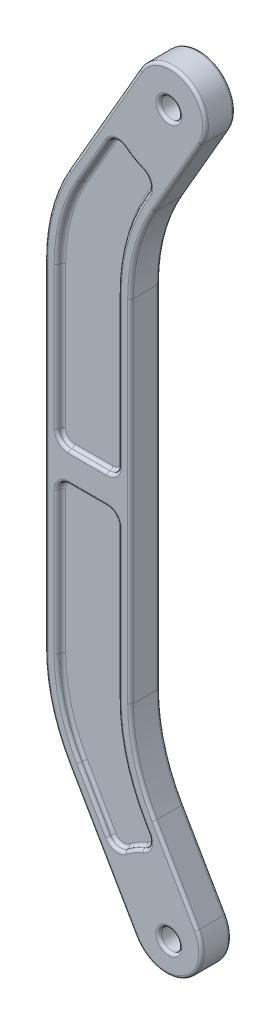
from build123d import *

# Parameters (mm, degrees)
EXTRUDE1_DEPTH      = 25
EXTRUDE1_DEPTH_BACK = 25
SKETCH3_R           = 17.13551903
SKETCH3_R_2         = 17.231991139
CUT_EXTRUDE1_DEPTH  = 10
CUT_EXTRUDE2_START  = -10
CUT_EXTRUDE2_DEPTH  = 10
FILLET1_R           = 4.826


with BuildPart() as part:
    # Sketch3 → Extrude1 (new, two sides: drawn at the far end of the back side and taken through both)
    with BuildSketch(Plane.XY.offset(-EXTRUDE1_DEPTH_BACK)):
        with BuildLine():
            Line((-24.807604607, 162.968065467), (47.382967486, 37.930316294))
            ThreePointArc((47.382967486, 37.930316294), (25.421440238, -44.031207308), (-56.540083363, -22.06968006))
            Line((-56.540083363, -22.06968006), (-169.807605742, 174.115435466))
            ThreePointArc((-169.807605742, 174.115435466), (-199.777732741, 246.469720642), (-209.99998495, 324.115433051))
            Line((-209.99998495, 324.115433051), (-209.99998495, 895.884583051))
            ThreePointArc((-209.99998495, 895.884583051), (-199.777733234, 973.530293564), (-169.807607648, 1045.884577221))
            Line((-169.807607648, 1045.884577221), (-49.82465968, 1253.701139142))
            ThreePointArc((-49.82465968, 1253.701139142), (32.136867624, 1275.662663595), (54.098392078, 1193.701136291))
            Line((54.098392078, 1193.701136291), (-24.807602614, 1057.031932005))
            ThreePointArc((-24.807602614, 1057.031932005), (-54.777728484, 984.677646375), (-64.999978983, 907.031933753))
            Line((-64.999978983, 907.031933753), (-64.999978983, 312.968053753))
            ThreePointArc((-64.999978983, 312.968053753), (-54.777728023, 235.322346461), (-24.807604607, 162.968065467))
        make_face()
        with Locations((0.048253388, 1219.998843051)):
            Circle(SKETCH3_R, mode=Mode.SUBTRACT)
        Circle(SKETCH3_R_2, mode=Mode.SUBTRACT)
    extrude(amount=EXTRUDE1_DEPTH + EXTRUDE1_DEPTH_BACK)

    # Sketch4 → Cut-Extrude1 (cut)
    with BuildSketch(Plane.XY.offset(25)):
        with BuildLine():
            Line((-85.317537612, 654.250003051), (-85.317530612, 907.031943051))
            ThreePointArc((-85.317530612, 907.031943051), (-74.402975126, 989.936220177), (-42.403118467, 1067.19070782))
            Line((-42.403118467, 1067.19070782), (-34.916014702, 1080.158771121))
            ThreePointArc((-34.916014702, 1080.158771121), (-33.363347921, 1096.442599596), (-44.656305727, 1108.276573903))
            ThreePointArc((-44.656305727, 1108.276573903), (-60.158769666, 1115.801958004), (-74.427174934, 1125.464794293))
            ThreePointArc((-74.427174934, 1125.464794293), (-90.322173256, 1129.327794011), (-103.648046289, 1119.841232651))
            Line((-103.648046289, 1119.841232651), (-152.212117713, 1035.725805096))
            ThreePointArc((-152.212117713, 1035.725805096), (-180.152510116, 968.271725823), (-189.682457612, 895.884583051))
            Line((-189.682457612, 895.884583051), (-189.682457612, 654.250003051))
            ThreePointArc((-189.682457612, 654.250003051), (-183.917598549, 640.332402114), (-169.999997612, 634.567543051))
            Line((-169.999997612, 634.567543051), (-104.999997612, 634.567543051))
            ThreePointArc((-104.999997612, 634.567543051), (-91.082396676, 640.332402114), (-85.317537612, 654.250003051))
        make_face()
        with BuildLine():
            Line((-152.212114349, 184.274207066), (-103.648045955, 100.158773186))
            ThreePointArc((-103.648045955, 100.158773186), (-90.322172483, 90.672211653), (-74.427173724, 94.535211517))
            ThreePointArc((-74.427173724, 94.535211517), (-60.158768087, 104.198048078), (-44.656303761, 111.723432429))
            ThreePointArc((-44.656303761, 111.723432429), (-33.363351675, 123.557400275), (-34.916017531, 139.841220175))
            Line((-34.916017531, 139.841220175), (-42.403127531, 152.809280175))
            ThreePointArc((-42.403127531, 152.809280175), (-74.402986959, 230.063776572), (-85.317541475, 312.968063051))
            Line((-85.317541475, 312.968063051), (-85.317541475, 564.750003051))
            ThreePointArc((-85.317541475, 564.750003051), (-91.082399138, 578.667600573), (-104.999996681, 584.432458189))
            Line((-104.999996681, 584.432458189), (-169.999996647, 584.432463051))
            ThreePointArc((-169.999996647, 584.432463051), (-183.917597561, 578.667603975), (-189.682456612, 564.750003051))
            Line((-189.682456612, 564.750003051), (-189.682456612, 324.115433051))
            ThreePointArc((-189.682456612, 324.115433051), (-180.152508504, 251.72828807), (-152.212114349, 184.274207066))
        make_face()
    extrude(amount=-CUT_EXTRUDE1_DEPTH, mode=Mode.SUBTRACT)

    # Sketch5 → Cut-Extrude2 (cut)
    with BuildSketch(Plane(origin=(0, 0, -25), x_dir=(-1, 0, 0), z_dir=(0, 0, -1)).offset(CUT_EXTRUDE2_START)):
        with BuildLine():
            Line((85.317530612, 907.031943051), (85.317537612, 654.250003051))
            ThreePointArc((85.317537612, 654.250003051), (91.082396676, 640.332402114), (104.999997612, 634.567543051))
            Line((104.999997612, 634.567543051), (169.999997612, 634.567543051))
            ThreePointArc((169.999997612, 634.567543051), (183.917598549, 640.332402114), (189.682457612, 654.250003051))
            Line((189.682457612, 654.250003051), (189.682457612, 895.884583051))
            ThreePointArc((189.682457612, 895.884583051), (180.152510116, 968.271725823), (152.212117713, 1035.725805096))
            Line((152.212117713, 1035.725805096), (103.648046289, 1119.841232651))
            ThreePointArc((103.648046289, 1119.841232651), (90.322173256, 1129.327794011), (74.427174934, 1125.464794293))
            ThreePointArc((74.427174934, 1125.464794293), (60.158769666, 1115.801958004), (44.656305727, 1108.276573903))
            ThreePointArc((44.656305727, 1108.276573903), (33.363347921, 1096.442599596), (34.916014702, 1080.158771121))
            Line((34.916014702, 1080.158771121), (42.403118467, 1067.19070782))
            ThreePointArc((42.403118467, 1067.19070782), (74.402975126, 989.936220177), (85.317530612, 907.031943051))
        make_face()
        with BuildLine():
            Line((103.648045955, 100.158773186), (152.212114349, 184.274207066))
            ThreePointArc((152.212114349, 184.274207066), (180.152508504, 251.72828807), (189.682456612, 324.115433051))
            Line((189.682456612, 324.115433051), (189.682456612, 564.750003051))
            ThreePointArc((189.682456612, 564.750003051), (183.917597561, 578.667603975), (169.999996647, 584.432463051))
            Line((169.999996647, 584.432463051), (104.999996681, 584.432458189))
            ThreePointArc((104.999996681, 584.432458189), (91.082399138, 578.667600573), (85.317541475, 564.750003051))
            Line((85.317541475, 564.750003051), (85.317541475, 312.968063051))
            ThreePointArc((85.317541475, 312.968063051), (74.402986959, 230.063776572), (42.403127531, 152.809280175))
            Line((42.403127531, 152.809280175), (34.916017531, 139.841220175))
            ThreePointArc((34.916017531, 139.841220175), (33.363351675, 123.557400275), (44.656303761, 111.723432429))
            ThreePointArc((44.656303761, 111.723432429), (60.158768087, 104.198048078), (74.427173724, 94.535211517))
            ThreePointArc((74.427173724, 94.535211517), (90.322172483, 90.672211653), (103.648045955, 100.158773186))
        make_face()
    extrude(amount=CUT_EXTRUDE2_DEPTH, mode=Mode.SUBTRACT)

    # Fillet1
    fillet1_edges = [part.edges().sort_by_distance(p)[0] for p in [
        (-64.999978983, 609.999993753, 25),
        (-64.999978983, 609.999993753, -25),
        (-54.777728484, 984.677646375, 25),
        (-54.777728023, 235.322346461, 25),
        (14.645394732, 1125.366534148, 25),
        (11.28768144, 100.44919088, 25),
        (32.136867624, 1275.662663595, 25),
        (25.421440238, -44.031207308, 25),
        (-109.816133664, 1149.792858181, 25),
        (-113.173844553, 76.022877703, 25),
        (-199.777733234, 973.530293564, 25),
        (-199.777732741, 246.469720642, 25),
        (-209.99998495, 610.000008051, 25),
        (-17.231991139, 0, 25),
        (-180.152508504, 251.72828807, 25),
        (-189.682456612, 444.432718051, 25),
        (-183.917597561, 578.667603975, 25),
        (-137.499996664, 584.43246062, 25),
        (-91.082399138, 578.667600573, 25),
        (-85.317541475, 438.859033051, 25),
        (-74.402986959, 230.063776572, 25),
        (-38.659572531, 146.325250175, 25),
        (-33.363351675, 123.557400275, 25),
        (-60.158768087, 104.198048078, 25),
        (-90.322172483, 90.672211653, 25),
        (-127.930080152, 142.216490126, 25),
        (-17.087265643, 1219.998843051, 25),
        (-90.322173256, 1129.327794011, 25),
        (-60.158769666, 1115.801958004, 25),
        (-33.363347921, 1096.442599596, 25),
        (-38.659566585, 1073.67473947, 25),
        (-74.402975126, 989.936220177, 25),
        (-85.317534112, 780.640973051, 25),
        (-91.082396676, 640.332402114, 25),
        (-137.499997612, 634.567543051, 25),
        (-183.917598549, 640.332402114, 25),
        (-189.682457612, 775.067293051, 25),
        (-180.152510116, 968.271725823, 25),
        (-127.930082001, 1077.783518873, 25),
        (-54.777728023, 235.322346461, -25),
        (-54.777728484, 984.677646375, -25),
        (14.645394732, 1125.366534148, -25),
        (11.28768144, 100.44919088, -25),
        (32.136867624, 1275.662663595, -25),
        (25.421440238, -44.031207308, -25),
        (-109.816133664, 1149.792858181, -25),
        (-113.173844553, 76.022877703, -25),
        (-199.777733234, 973.530293564, -25),
        (-199.777732741, 246.469720642, -25),
        (-209.99998495, 610.000008051, -25),
        (-17.231991139, 0, -25),
        (-38.659572531, 146.325250175, -25),
        (-33.363351675, 123.557400275, -25),
        (-60.158768087, 104.198048078, -25),
        (-90.322172483, 90.672211653, -25),
        (-127.930080152, 142.216490126, -25),
        (-180.152508504, 251.72828807, -25),
        (-189.682456612, 444.432718051, -25),
        (-183.917597561, 578.667603975, -25),
        (-137.499996664, 584.43246062, -25),
        (-91.082399138, 578.667600573, -25),
        (-85.317541475, 438.859033051, -25),
        (-74.402986959, 230.063776572, -25),
        (-17.087265643, 1219.998843051, -25),
        (-38.659566585, 1073.67473947, -25),
        (-74.402975126, 989.936220177, -25),
        (-85.317534112, 780.640973051, -25),
        (-91.082396676, 640.332402114, -25),
        (-137.499997612, 634.567543051, -25),
        (-183.917598549, 640.332402114, -25),
        (-189.682457612, 775.067293051, -25),
        (-180.152510116, 968.271725823, -25),
        (-127.930082001, 1077.783518873, -25),
        (-90.322173256, 1129.327794011, -25),
        (-60.158769666, 1115.801958004, -25),
        (-33.363347921, 1096.442599596, -25),
        (-180.152508504, 251.72828807, 15),
        (-189.682456612, 444.432718051, 15),
        (-183.917597561, 578.667603975, 15),
        (-137.499996664, 584.43246062, 15),
        (-91.082399138, 578.667600573, 15),
        (-85.317541475, 438.859033051, 15),
        (-74.402986959, 230.063776572, 15),
        (-38.659572531, 146.325250175, 15),
        (-33.363351675, 123.557400275, 15),
        (-60.158768087, 104.198048078, 15),
        (-90.322172483, 90.672211653, 15),
        (-127.930080152, 142.216490126, 15),
        (-90.322173256, 1129.327794011, 15),
        (-60.158769666, 1115.801958004, 15),
        (-33.363347921, 1096.442599596, 15),
        (-38.659566585, 1073.67473947, 15),
        (-74.402975126, 989.936220177, 15),
        (-85.317534112, 780.640973051, 15),
        (-91.082396676, 640.332402114, 15),
        (-137.499997612, 634.567543051, 15),
        (-183.917598549, 640.332402114, 15),
        (-189.682457612, 775.067293051, 15),
        (-180.152510116, 968.271725823, 15),
        (-127.930082001, 1077.783518873, 15),
        (-38.659572531, 146.325250175, -15),
        (-33.363351675, 123.557400275, -15),
        (-60.158768087, 104.198048078, -15),
        (-90.322172483, 90.672211653, -15),
        (-127.930080152, 142.216490126, -15),
        (-180.152508504, 251.72828807, -15),
        (-189.682456612, 444.432718051, -15),
        (-183.917597561, 578.667603975, -15),
        (-137.499996664, 584.43246062, -15),
        (-91.082399138, 578.667600573, -15),
        (-85.317541475, 438.859033051, -15),
        (-74.402986959, 230.063776572, -15),
        (-38.659566585, 1073.67473947, -15),
        (-74.402975126, 989.936220177, -15),
        (-85.317534112, 780.640973051, -15),
        (-91.082396676, 640.332402114, -15),
        (-137.499997612, 634.567543051, -15),
        (-183.917598549, 640.332402114, -15),
        (-189.682457612, 775.067293051, -15),
        (-180.152510116, 968.271725823, -15),
        (-127.930082001, 1077.783518873, -15),
        (-90.322173256, 1129.327794011, -15),
        (-60.158769666, 1115.801958004, -15),
        (-33.363347921, 1096.442599596, -15),
    ]]
    fillet(fillet1_edges, radius=FILLET1_R)


solid = part.part
